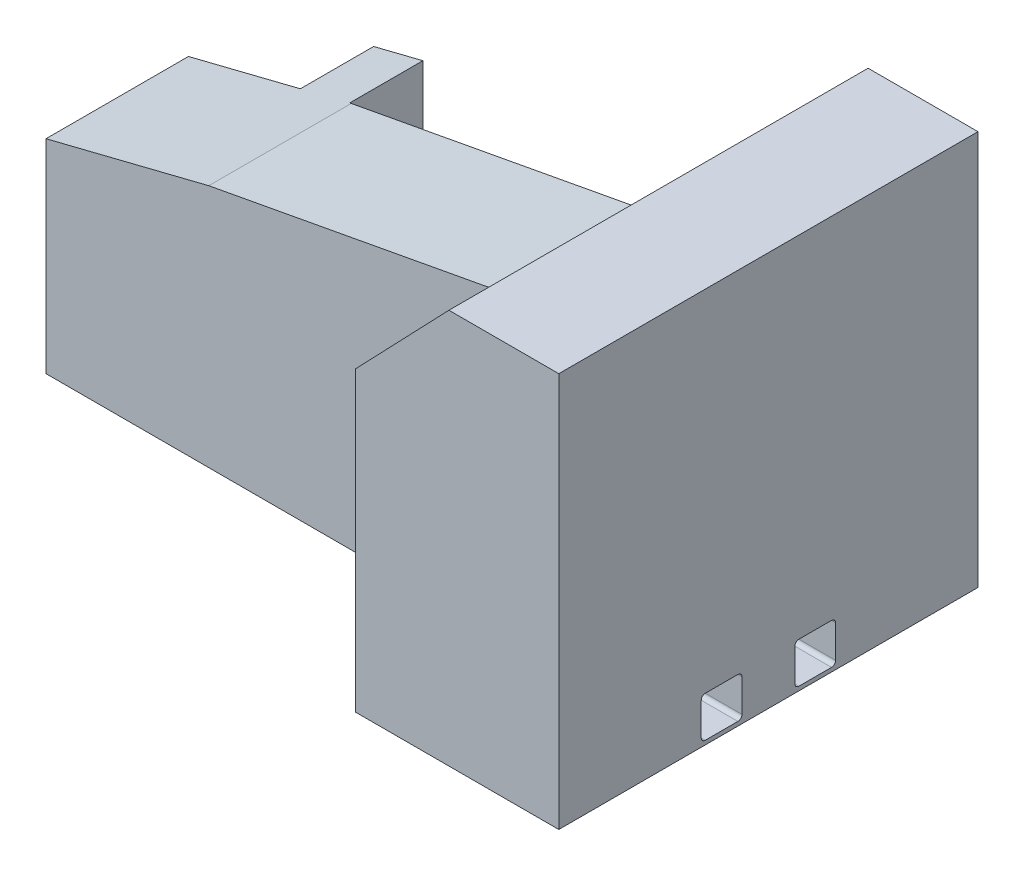
from build123d import *

# Parameters (mm, degrees)
SKETCH2_W               = 121
SKETCH2_H               = 180
BOSS_EXTRUDE1_DEPTH     = 970
CUT_EXTRUDE1_DEPTH      = 1359.721825835
CUT_EXTRUDE1_DEPTH_BACK = 1359.721825835
CUT_EXTRUDE5_DEPTH      = 1625
SKETCH4_R               = 8.5
CUT_EXTRUDE6_DEPTH      = 78


with BuildPart() as part:
    # Sketch2 → Boss-Extrude1 (new body)
    with BuildSketch(Plane(origin=(0, 0, 0), x_dir=(1, 0, 0), z_dir=(0, 1, 0))):
        Polygon((300, -515), (800, -515), (800, 515), (300, 515), (300, 175), (-404, 175), (-525, 175), (-800, 175), (-800, -175), (300, -175), align=None)
        with Locations((-464.5, 265)):
            Rectangle(SKETCH2_W, SKETCH2_H)
    extrude(amount=BOSS_EXTRUDE1_DEPTH)

    # Sketch1 → Cut-Extrude1 (cut, two sides: drawn at the far end of the back side and taken through both)
    with BuildSketch(Plane.XY.offset(-CUT_EXTRUDE1_DEPTH_BACK)):
        Polygon((-800, 970), (530, 970), (300, 730), (-400, 600), (-800, 500), align=None)
    extrude(amount=CUT_EXTRUDE1_DEPTH + CUT_EXTRUDE1_DEPTH_BACK, mode=Mode.SUBTRACT)

    # Sketch3 → Cut-Extrude5 (cut)
    with BuildSketch(Plane.ZY.offset(800)):
        with BuildLine():
            Line((-165, 100), (-165, 20))
            ThreePointArc((-165, 20), (-162.071067812, 12.928932188), (-155, 10))
            Line((-155, 10), (-75, 10))
            ThreePointArc((-75, 10), (-67.928932188, 12.928932188), (-65, 20))
            Line((-65, 20), (-65, 100))
            ThreePointArc((-65, 100), (-67.928932188, 107.071067812), (-75, 110))
            Line((-75, 110), (-155, 110))
            ThreePointArc((-155, 110), (-162.071067812, 107.071067812), (-165, 100))
        make_face()
        with BuildLine():
            Line((75, 110), (155, 110))
            ThreePointArc((155, 110), (162.071067812, 107.071067812), (165, 100))
            Line((165, 100), (165, 20))
            ThreePointArc((165, 20), (162.071067812, 12.928932188), (155, 10))
            Line((155, 10), (75, 10))
            ThreePointArc((75, 10), (67.928932188, 12.928932188), (65, 20))
            Line((65, 20), (65, 100))
            ThreePointArc((65, 100), (67.928932188, 107.071067812), (75, 110))
        make_face()
    extrude(amount=-CUT_EXTRUDE5_DEPTH, mode=Mode.SUBTRACT)

    # Sketch4 → Cut-Extrude6 (cut)
    with BuildSketch(Plane.XZ):
        with Locations(Location((-498.5, 115, 0), (0, 0, 270))):
            Circle(SKETCH4_R)
        with Locations(Location((-501, -115, 0), (0, 0, 270))):
            Circle(SKETCH4_R)
        with Locations(Location((501, -115, 0), (0, 0, 270))):
            Circle(SKETCH4_R)
        with Locations(Location((498.5, 115, 0), (0, 0, 90))):
            Circle(SKETCH4_R)
    extrude(amount=-CUT_EXTRUDE6_DEPTH, mode=Mode.SUBTRACT)


solid = part.part
